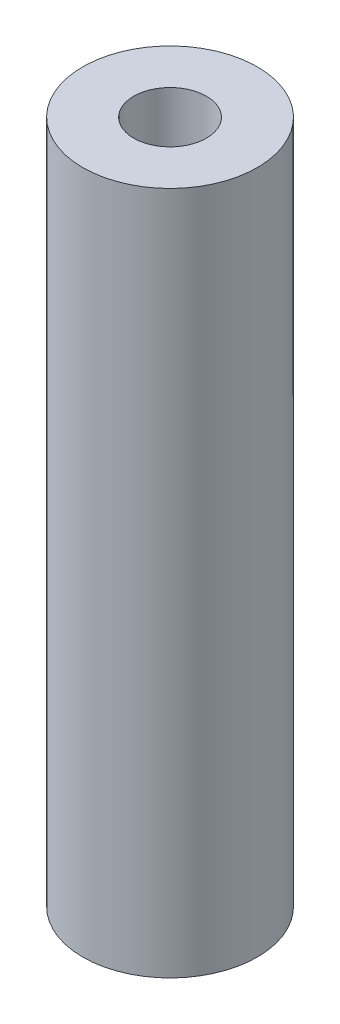
from build123d import *

# Parameters (mm, degrees)
SKETCH1_R                   = 3
BOSS_EXTRUDE1_DEPTH         = 23.5
TAP_DRILL_FOR_M3X0_5_TAP1_D = 2.5


with BuildPart() as part:
    # Sketch1 → Boss-Extrude1 (new body)
    with BuildSketch(Plane(origin=(0, 0, 0), x_dir=(1, 0, 0), z_dir=(0, 1, 0))):
        with Locations(Location((0, 0, 0), (0, 0, 270))):
            Circle(SKETCH1_R)
    extrude(amount=BOSS_EXTRUDE1_DEPTH)

    # Tap Drill for M3x0.5 Tap1 (through all)
    with Locations(Plane(origin=(0, 23.5, 0), x_dir=(1, 0, 0), z_dir=(0, 1, 0))):
        with Locations((0, 0)):
            Hole(TAP_DRILL_FOR_M3X0_5_TAP1_D / 2)


solid = part.part
